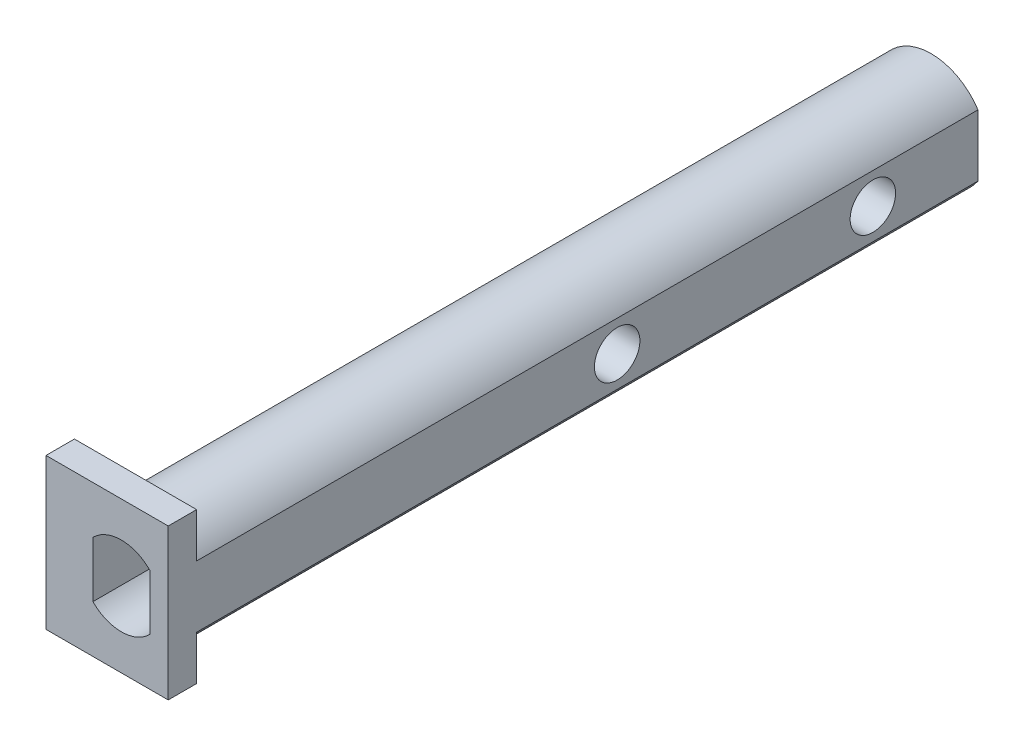
from build123d import *

# Parameters (mm, degrees)
IZIM1_W                     = 10.606601718
IZIM1_H                     = 10.606601718
Y_KSEKLIK_EKSTR_ZYON1_DEPTH = 2
IZIM2_R                     = 3.95
Y_KSEKLIK_EKSTR_ZYON2_DEPTH = 55
KES_EKSTR_ZYON1_DEPTH       = 10
IZIM5_R                     = 1.6
KES_EKSTR_ZYON3_DEPTH       = 26
IZIM8_W                     = 5
IZIM8_H                     = 13.621024602
KES_EKSTR_ZYON4_DEPTH       = 58.49130369


with BuildPart() as part:
    # Çizim1 → Yükseklik-Ekstrüzyon1 (new body)
    with BuildSketch(Plane.XY):
        Rectangle(IZIM1_W, IZIM1_H)
    extrude(amount=Y_KSEKLIK_EKSTR_ZYON1_DEPTH)

    # Çizim2 → Yükseklik-Ekstrüzyon2 (add)
    with BuildSketch(Plane(origin=(0, 0, 0), x_dir=(-1, 0, 0), z_dir=(0, 0, -1))):
        with Locations(Location((0, 0, 0), (0, 0, 180))):
            Circle(IZIM2_R)
    extrude(amount=Y_KSEKLIK_EKSTR_ZYON2_DEPTH)

    # Çizim3 → Kes-Ekstrüzyon1 (cut)
    with BuildSketch(Plane.XY.offset(2)):
        with BuildLine():
            Line((-2, -1.959591794), (-2, 1.959591794))
            ThreePointArc((-2, 1.959591794), (0, 2.8), (2, 1.959591794))
            Line((2, 1.959591794), (2, -1.959591794))
            ThreePointArc((2, -1.959591794), (0, -2.8), (-2, -1.959591794))
        make_face()
    extrude(amount=-KES_EKSTR_ZYON1_DEPTH, mode=Mode.SUBTRACT)

    # Çizim5 → Kes-Ekstrüzyon3 (cut, symmetric)
    with BuildSketch(Plane(origin=(0, 0, 0), x_dir=(0, 0, -1), z_dir=(1, 0, 0))):
        with Locations((29.6, 0)):
            Circle(IZIM5_R)
        with Locations((47.6, 0)):
            Circle(IZIM5_R)
    extrude(amount=KES_EKSTR_ZYON3_DEPTH, both=True, mode=Mode.SUBTRACT)

    # Çizim8 → Kes-Ekstrüzyon4 (cut, through all)
    with BuildSketch(Plane(origin=(0, 0, -55), x_dir=(-1, 0, 0), z_dir=(0, 0, -1))):
        with Locations((-5.8, 0)):
            Rectangle(IZIM8_W, IZIM8_H)
    extrude(amount=-KES_EKSTR_ZYON4_DEPTH, mode=Mode.SUBTRACT)


solid = part.part
